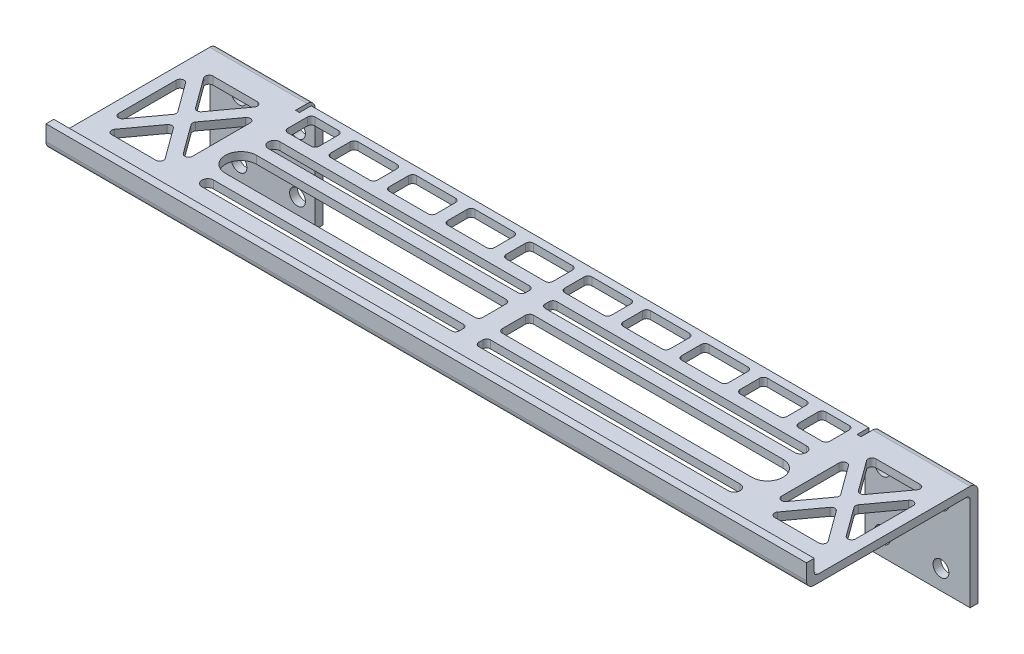
from build123d import *

# Parameters (mm, degrees)
SKETCH1_W           = 195
SKETCH1_H           = 35
BOSS_EXTRUDE1_DEPTH = 2
SKETCH2_W           = 25
SKETCH2_H           = 27
BOSS_EXTRUDE2_DEPTH = 2
FILLET1_R           = 2
FILLET2_R           = 1
SKETCH3_W           = 1
SKETCH3_H           = 3
CUT_EXTRUDE1_DEPTH  = 104.031548566
CUT_EXTRUDE2_DEPTH  = 104.031548566
CUT_EXTRUDE4_DEPTH  = 104.031548566
FILLET3_R           = 1
SKETCH7_R           = 2.025
CUT_EXTRUDE5_DEPTH  = 108.239218572
SKETCH8_W           = 2
SKETCH8_H           = 23
BOSS_EXTRUDE3_DEPTH = 2
SKETCH10_W          = 195
SKETCH10_H          = 5
BOSS_EXTRUDE5_DEPTH = 2
SKETCH11_W          = 195
SKETCH11_H          = 6
BOSS_EXTRUDE6_DEPTH = 2
FILLET4_R           = 1
FILLET5_R           = 2
CUT_EXTRUDE6_DEPTH  = 10
SKETCH14_W          = 3
SKETCH14_H          = 6.9975
BOSS_EXTRUDE8_DEPTH = 2
FILLET8_R           = 1
SKETCH15_W          = 5
SKETCH15_H          = 20.005
BOSS_EXTRUDE9_DEPTH = 2
FILLET9_R           = 1


with BuildPart() as part:
    # Sketch1 → Boss-Extrude1 (new body)
    with BuildSketch(Plane(origin=(0, 0, 0), x_dir=(1, 0, 0), z_dir=(0, 1, 0))):
        Rectangle(SKETCH1_W, SKETCH1_H)
    extrude(amount=BOSS_EXTRUDE1_DEPTH)

    # Sketch2 → Boss-Extrude2 (add)
    with BuildSketch(Plane(origin=(0, 0, -17.5), x_dir=(-1, 0, 0), z_dir=(0, 0, -1))):
        with Locations((-85, -11.5)):
            Rectangle(SKETCH2_W, SKETCH2_H)
        with Locations((85, -11.5)):
            Rectangle(SKETCH2_W, SKETCH2_H)
    extrude(amount=BOSS_EXTRUDE2_DEPTH)

    # Fillet1
    fillet1_edges = [part.edges().sort_by_distance(p)[0] for p in [
        (-85, 2, -19.5),
        (85, 2, -19.5),
    ]]
    fillet(fillet1_edges, radius=FILLET1_R)

    # Fillet2
    fillet2_edges = [part.edges().sort_by_distance(p)[0] for p in [
        (-85, 0, -17.5),
        (85, 0, -17.5),
    ]]
    fillet(fillet2_edges, radius=FILLET2_R)

    # Sketch3 → Cut-Extrude1 (cut, through all)
    with BuildSketch(Plane(origin=(0, 2, 0), x_dir=(1, 0, 0), z_dir=(0, 1, 0))):
        with Locations((-72, 16)):
            Rectangle(SKETCH3_W, SKETCH3_H)
        with Locations((72, 16)):
            Rectangle(SKETCH3_W, SKETCH3_H)
    extrude(amount=-CUT_EXTRUDE1_DEPTH, mode=Mode.SUBTRACT)

    # Sketch4 → Cut-Extrude2 (cut, through all)
    with BuildSketch(Plane(origin=(0, 2, 0), x_dir=(1, 0, 0), z_dir=(0, 1, 0))):
        with BuildLine():
            Line((-67.5, -0.5), (67.5, -0.5))
            ThreePointArc((67.5, -0.5), (71.5, -4.5), (67.5, -8.5))
            Line((67.5, -8.5), (-67.5, -8.5))
            ThreePointArc((-67.5, -8.5), (-71.5, -4.5), (-67.5, -0.5))
        make_face()
        with BuildLine():
            Line((-67.5, 5.5025), (67.5, 5.5025))
            ThreePointArc((67.5, 5.5025), (69.0025, 4), (67.5, 2.4975))
            Line((67.5, 2.4975), (-67.5, 2.4975))
            ThreePointArc((-67.5, 2.4975), (-69.0025, 4), (-67.5, 5.5025))
        make_face()
        with BuildLine():
            Line((-67.5, -14.5025), (67.5, -14.5025))
            ThreePointArc((67.5, -14.5025), (69.0025, -13), (67.5, -11.4975))
            Line((67.5, -11.4975), (-67.5, -11.4975))
            ThreePointArc((-67.5, -11.4975), (-69.0025, -13), (-67.5, -14.5025))
        make_face()
    extrude(amount=-CUT_EXTRUDE2_DEPTH, mode=Mode.SUBTRACT)

    # Sketch6 → Cut-Extrude4 (cut, through all)
    with BuildSketch(Plane(origin=(0, 2, 0), x_dir=(1, 0, 0), z_dir=(0, 1, 0))):
        Polygon((-75.5, 8.957698602), (-75.5, -11.957698602), (-83.142164363, -1.5), align=None)
        Polygon((-77.357835637, -14.5), (-92.642164363, -14.5), (-85, -4.042301398), align=None)
        Polygon((-94.5, 8.957698602), (-94.5, -11.957698602), (-86.857835637, -1.5), align=None)
        Polygon((-77.357835637, 11.5), (-92.642164363, 11.5), (-85, 1.042301398), align=None)
        Polygon((83.142164363, -1.5), (75.5, -11.957698602), (75.5, 8.957698602), align=None)
        Polygon((85, -4.042301398), (92.642164363, -14.5), (77.357835637, -14.5), align=None)
        Polygon((86.857835637, -1.5), (94.5, -11.957698602), (94.5, 8.957698602), align=None)
        Polygon((92.642164363, 11.5), (85, 1.042301398), (77.357835637, 11.5), align=None)
    extrude(amount=-CUT_EXTRUDE4_DEPTH, mode=Mode.SUBTRACT)

    # Fillet3
    fillet3_edges = [part.edges().sort_by_distance(p)[0] for p in [
        (75.5, 1, -8.957698602),
        (83.142164363, 1, 1.5),
        (75.5, 1, 11.957698602),
        (-85, 1, 4.042301398),
        (-77.357835637, 1, 14.5),
        (-92.642164363, 1, 14.5),
        (-83.142164363, 1, 1.5),
        (-75.5, 1, -8.957698602),
        (-75.5, 1, 11.957698602),
        (-94.5, 1, -8.957698602),
        (-86.857835637, 1, 1.5),
        (-94.5, 1, 11.957698602),
        (77.357835637, 1, -11.5),
        (92.642164363, 1, -11.5),
        (85, 1, -1.042301398),
        (77.357835637, 1, 14.5),
        (85, 1, 4.042301398),
        (92.642164363, 1, 14.5),
        (86.857835637, 1, 1.5),
        (94.5, 1, -8.957698602),
        (94.5, 1, 11.957698602),
        (-85, 1, -1.042301398),
        (-92.642164363, 1, -11.5),
        (-77.357835637, 1, -11.5),
    ]]
    fillet(fillet3_edges, radius=FILLET3_R)

    # Sketch7 → Cut-Extrude5 (cut, through all)
    with BuildSketch(Plane(origin=(0, 0, -19.5), x_dir=(-1, 0, 0), z_dir=(0, 0, -1))):
        with Locations((-90, -5)):
            Circle(SKETCH7_R)
        with Locations((-75, -5)):
            Circle(SKETCH7_R)
        with Locations((-75, -20)):
            Circle(SKETCH7_R)
        with Locations((-90, -20)):
            Circle(SKETCH7_R)
        with Locations(Location((90, -20, 0), (0, 0, 180))):
            Circle(SKETCH7_R)
        with Locations(Location((75, -20, 0), (0, 0, 180))):
            Circle(SKETCH7_R)
        with Locations(Location((75, -5, 0), (0, 0, 180))):
            Circle(SKETCH7_R)
        with Locations(Location((90, -5, 0), (0, 0, 180))):
            Circle(SKETCH7_R)
    extrude(amount=-CUT_EXTRUDE5_DEPTH, mode=Mode.SUBTRACT)

    # Sketch8 → Boss-Extrude3 (add)
    with BuildSketch(Plane(origin=(0, 0, -19.5), x_dir=(-1, 0, 0), z_dir=(0, 0, -1))):
        with Locations((-71.5, -13.5)):
            Rectangle(SKETCH8_W, SKETCH8_H)
        with Locations((71.5, -13.5)):
            Rectangle(SKETCH8_W, SKETCH8_H)
    extrude(amount=-BOSS_EXTRUDE3_DEPTH)

    # Sketch10 → Boss-Extrude5 (add)
    with BuildSketch(Plane(origin=(0, 2, 0), x_dir=(1, 0, 0), z_dir=(0, 1, 0))):
        with Locations((0, -20)):
            Rectangle(SKETCH10_W, SKETCH10_H)
    extrude(amount=-BOSS_EXTRUDE5_DEPTH)

    # Sketch11 → Boss-Extrude6 (add)
    with BuildSketch(Plane.XY.offset(22.5)):
        with Locations((0, 3)):
            Rectangle(SKETCH11_W, SKETCH11_H)
    extrude(amount=BOSS_EXTRUDE6_DEPTH)

    # Fillet4
    fillet4_edges = [part.edges().sort_by_distance(p)[0] for p in [
        (0, 2, 22.5),
    ]]
    fillet(fillet4_edges, radius=FILLET4_R)

    # Fillet5
    fillet5_edges = [part.edges().sort_by_distance(p)[0] for p in [
        (0, 0, 24.5),
    ]]
    fillet(fillet5_edges, radius=FILLET5_R)

    # Sketch13 → Cut-Extrude6 (cut)
    with BuildSketch(Plane(origin=(0, 2, 0), x_dir=(1, 0, 0), z_dir=(0, 1, 0))):
        with BuildLine():
            Line((-69.5, 14.5), (-69.5, 9.5025))
            ThreePointArc((-69.5, 9.5025), (-69.207106781, 8.795393219), (-68.5, 8.5025))
            Line((-68.5, 8.5025), (68.5, 8.5025))
            ThreePointArc((68.5, 8.5025), (69.207106781, 8.795393219), (69.5, 9.5025))
            Line((69.5, 9.5025), (69.5, 14.5))
            ThreePointArc((69.5, 14.5), (69.207106781, 15.207106781), (68.5, 15.5))
            Line((68.5, 15.5), (-68.5, 15.5))
            ThreePointArc((-68.5, 15.5), (-69.207106781, 15.207106781), (-69.5, 14.5))
        make_face()
    extrude(amount=-CUT_EXTRUDE6_DEPTH, mode=Mode.SUBTRACT)

    # Sketch14 → Boss-Extrude8 (add)
    with BuildSketch(Plane(origin=(0, 2, 0), x_dir=(1, 0, 0), z_dir=(0, 1, 0))):
        with Locations((0, 12.00125)):
            Rectangle(SKETCH14_W, SKETCH14_H)
        with Locations((15, 12.00125)):
            Rectangle(SKETCH14_W, SKETCH14_H)
        with Locations((30, 12.00125)):
            Rectangle(SKETCH14_W, SKETCH14_H)
        with Locations((45, 12.00125)):
            Rectangle(SKETCH14_W, SKETCH14_H)
        with Locations((60, 12.00125)):
            Rectangle(SKETCH14_W, SKETCH14_H)
        with Locations((-15, 12.00125)):
            Rectangle(SKETCH14_W, SKETCH14_H)
        with Locations((-30, 12.00125)):
            Rectangle(SKETCH14_W, SKETCH14_H)
        with Locations((-45, 12.00125)):
            Rectangle(SKETCH14_W, SKETCH14_H)
        with Locations((-60, 12.00125)):
            Rectangle(SKETCH14_W, SKETCH14_H)
    extrude(amount=-BOSS_EXTRUDE8_DEPTH)

    # Fillet8
    fillet8_edges = [part.edges().sort_by_distance(p)[0] for p in [
        (-1.5, 1, -8.5025),
        (-1.5, 1, -15.5),
        (1.5, 1, -15.5),
        (1.5, 1, -8.5025),
        (13.5, 1, -8.5025),
        (13.5, 1, -15.5),
        (16.5, 1, -15.5),
        (16.5, 1, -8.5025),
        (28.5, 1, -8.5025),
        (28.5, 1, -15.5),
        (31.5, 1, -15.5),
        (31.5, 1, -8.5025),
        (43.5, 1, -8.5025),
        (43.5, 1, -15.5),
        (46.5, 1, -15.5),
        (46.5, 1, -8.5025),
        (58.5, 1, -8.5025),
        (58.5, 1, -15.5),
        (61.5, 1, -15.5),
        (61.5, 1, -8.5025),
        (-16.5, 1, -8.5025),
        (-16.5, 1, -15.5),
        (-13.5, 1, -15.5),
        (-13.5, 1, -8.5025),
        (-31.5, 1, -8.5025),
        (-31.5, 1, -15.5),
        (-28.5, 1, -15.5),
        (-28.5, 1, -8.5025),
        (-46.5, 1, -8.5025),
        (-46.5, 1, -15.5),
        (-43.5, 1, -15.5),
        (-43.5, 1, -8.5025),
        (-61.5, 1, -8.5025),
        (-61.5, 1, -15.5),
        (-58.5, 1, -15.5),
        (-58.5, 1, -8.5025),
    ]]
    fillet(fillet8_edges, radius=FILLET8_R)

    # Sketch15 → Boss-Extrude9 (add)
    with BuildSketch(Plane(origin=(0, 2, 0), x_dir=(1, 0, 0), z_dir=(0, 1, 0))):
        with Locations((0, -4.5)):
            Rectangle(SKETCH15_W, SKETCH15_H)
    extrude(amount=-BOSS_EXTRUDE9_DEPTH)

    # Fillet9
    fillet9_edges = [part.edges().sort_by_distance(p)[0] for p in [
        (-2.5, 1, 0.5),
        (-2.5, 1, -2.4975),
        (-2.5, 1, 14.5025),
        (2.5, 1, 0.5),
        (2.5, 1, -2.4975),
        (2.5, 1, -5.5025),
        (-2.5, 1, 8.5),
        (-2.5, 1, 11.4975),
        (-2.5, 1, -5.5025),
        (2.5, 1, 8.5),
        (2.5, 1, 11.4975),
        (2.5, 1, 14.5025),
    ]]
    fillet(fillet9_edges, radius=FILLET9_R)


solid = part.part
